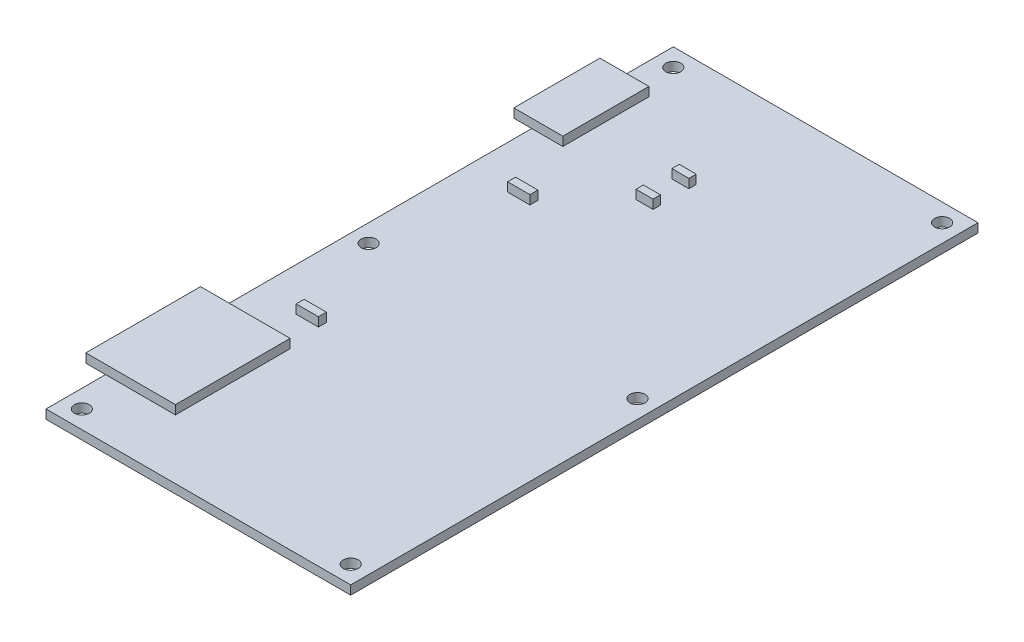
from build123d import *

# Parameters (mm, degrees)
SKETCH1_W                  = 107.95
SKETCH1_H                  = 222.25
BOSS_EXTRUDE1_DEPTH        = 3.175
SKETCH3_W                  = 17.3736
SKETCH3_H                  = 30.5054
SKETCH3_W_2                = 7.8994
SKETCH3_H_2                = 2.8194
SKETCH3_W_3                = 5.588
SKETCH3_H_3                = 32.2834
SKETCH3_W_4                = 6.0198
SKETCH3_H_4                = 2.6162
BOSS_EXTRUDE2_DEPTH        = 3.175
F_4_0_209_DIAMETER_HOLE1_D = 5.3086
SKETCH7_W                  = 31.75
SKETCH7_H                  = 40.64
BOSS_EXTRUDE3_DEPTH        = 3.175


with BuildPart() as part:
    # Sketch1 → Boss-Extrude1 (new body)
    with BuildSketch(Plane(origin=(0, 0, 0), x_dir=(1, 0, 0), z_dir=(0, 1, 0))):
        with Locations((53.975, 111.125)):
            Rectangle(SKETCH1_W, SKETCH1_H)
    extrude(amount=BOSS_EXTRUDE1_DEPTH)

    # Sketch3 → Boss-Extrude2 (add)
    with BuildSketch(Plane(origin=(0, 3.175, 0), x_dir=(1, 0, 0), z_dir=(0, 1, 0))):
        with Locations((2.3368, 187.3377)):
            Rectangle(SKETCH3_W, SKETCH3_H)
        with Locations((19.1897, 149.7203)):
            Rectangle(SKETCH3_W_2, SKETCH3_H_2)
        with Locations((19.1897, 74.7903)):
            Rectangle(SKETCH3_W_2, SKETCH3_H_2)
        with Locations((19.177, 38.2397)):
            Rectangle(SKETCH3_W_3, SKETCH3_H_3)
        with Locations((43.2943, 182.7657)):
            Rectangle(SKETCH3_W_4, SKETCH3_H_4)
        with Locations((43.2943, 170.0657)):
            Rectangle(SKETCH3_W_4, SKETCH3_H_4)
    extrude(amount=BOSS_EXTRUDE2_DEPTH)

    # #4 (0.209) Diameter Hole1 (through all)
    with Locations(Plane(origin=(0, 3.175, 0), x_dir=(1, 0, 0), z_dir=(0, 1, 0))):
        with Locations((101.6, 215.9), (101.6, 6.35), (6.35, 6.35), (6.35, 215.9), (6.35, 107.95), (101.6, 107.95)):
            Hole(F_4_0_209_DIAMETER_HOLE1_D / 2)

    # Sketch7 → Boss-Extrude3 (add)
    with BuildSketch(Plane(origin=(0, 6.35, 0), x_dir=(1, 0, 0), z_dir=(0, 1, 0))):
        with Locations((12.065, 38.2397)):
            Rectangle(SKETCH7_W, SKETCH7_H)
    extrude(amount=BOSS_EXTRUDE3_DEPTH)


solid = part.part
